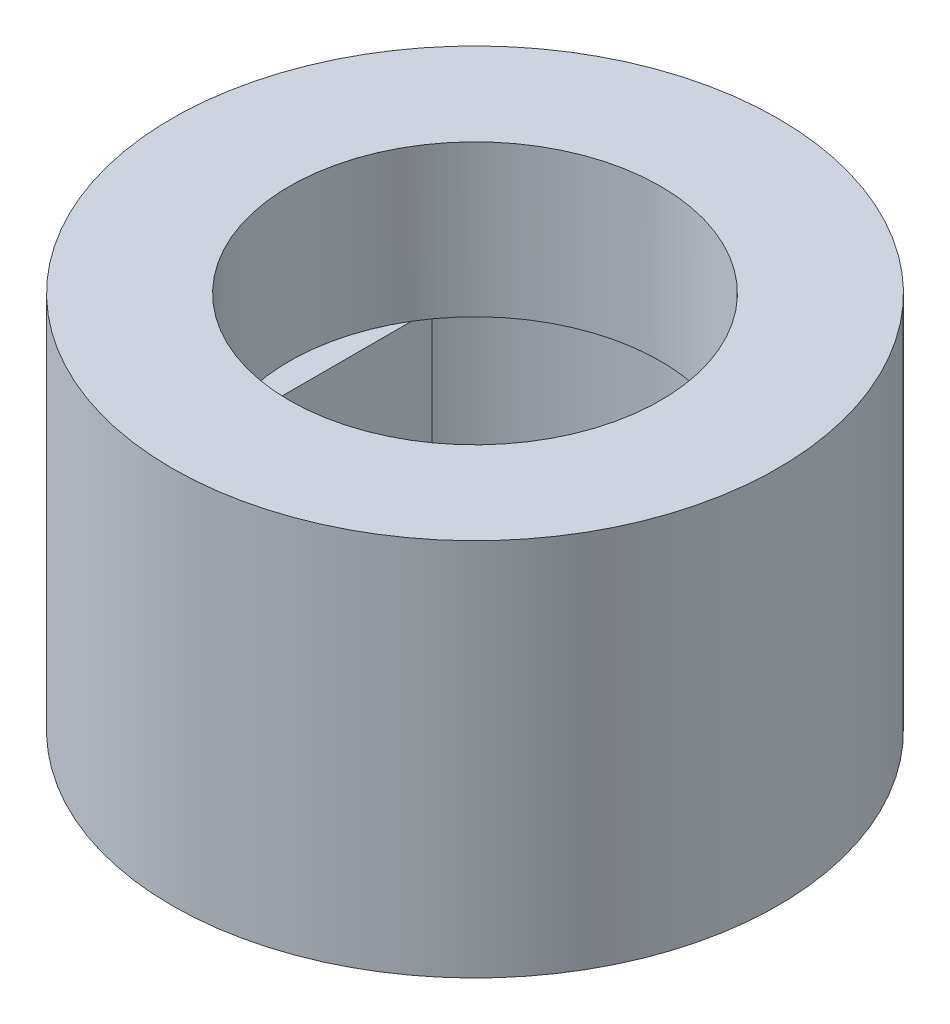
from build123d import *

# Parameters (mm, degrees)
SKETCH1_R           = 5.08
BOSS_EXTRUDE1_DEPTH = 6.35
CUT_EXTRUDE1_DEPTH  = 3.81
SKETCH3_R           = 3.1115
CUT_EXTRUDE2_DEPTH  = 2.54


with BuildPart() as part:
    # Sketch1 → Boss-Extrude1 (new body)
    with BuildSketch(Plane(origin=(0, 0, 0), x_dir=(1, 0, 0), z_dir=(0, 1, 0))):
        with Locations(Location((0, 0, 0), (0, 0, 270))):
            Circle(SKETCH1_R)
    extrude(amount=BOSS_EXTRUDE1_DEPTH)

    # Sketch2 → Cut-Extrude1 (cut)
    with BuildSketch(Plane(origin=(0, 0, 0), x_dir=(1, 0, 0), z_dir=(0, 1, 0))):
        with BuildLine():
            Line((-2.667, 1.946873134), (-2.667, -1.946873134))
            ThreePointArc((-2.667, -1.946873134), (1.023906734, -3.139238602), (3.302, 0))
            ThreePointArc((3.302, 0), (1.023906734, 3.139238602), (-2.667, 1.946873134))
        make_face()
    extrude(amount=CUT_EXTRUDE1_DEPTH, mode=Mode.SUBTRACT)

    # Sketch3 → Cut-Extrude2 (cut)
    with BuildSketch(Plane(origin=(0, 6.35, 0), x_dir=(1, 0, 0), z_dir=(0, 1, 0))):
        with Locations(Location((0, 0, 0), (0, 0, 270))):
            Circle(SKETCH3_R)
    extrude(amount=-CUT_EXTRUDE2_DEPTH, mode=Mode.SUBTRACT)


solid = part.part
